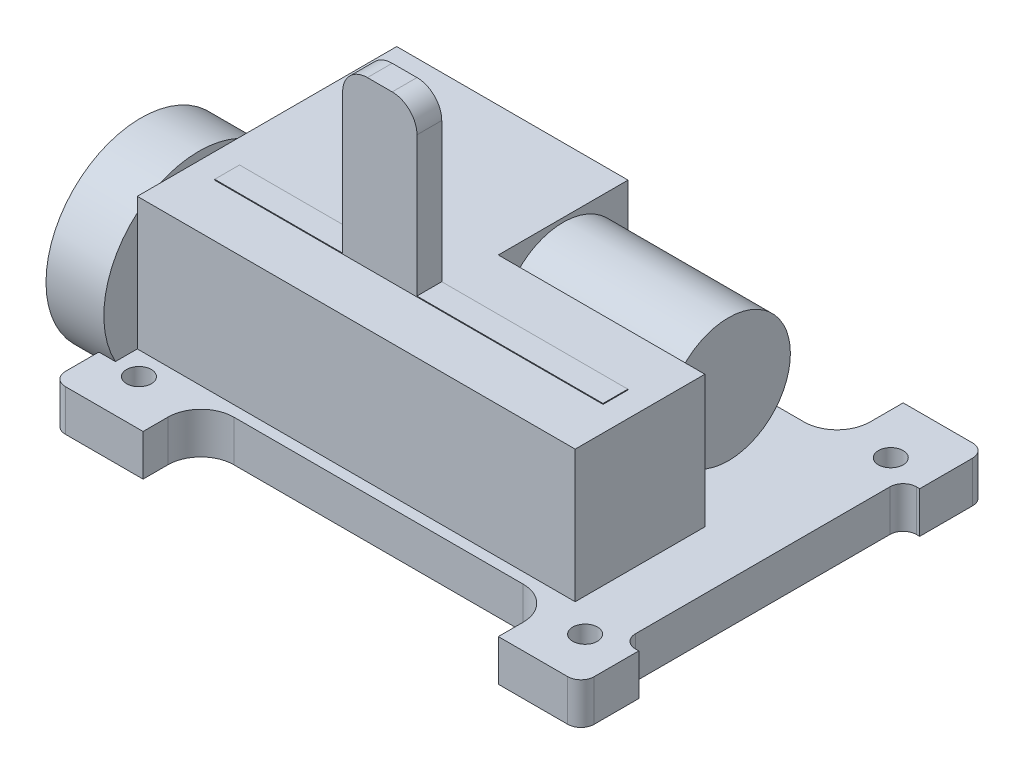
from build123d import *

# Parameters (mm, degrees)
SKETCH1_R            = 0.15
BOSS_EXTRUDE1_DEPTH  = 0.5
FILLET1_R            = 0.4
FILLET2_R            = 0.16
BOSS_EXTRUDE2_DEPTH  = 1.6
SKETCH3_R            = 0.75
BOSS_EXTRUDE7_DEPTH  = 2
SKETCH4_W            = 1.8
SKETCH4_H            = 1.8
BOSS_EXTRUDE8_DEPTH  = 0.3
SKETCH5_R            = 1.15
BOSS_EXTRUDE9_DEPTH  = 0.7
SKETCH6_W            = 0.9
SKETCH6_H            = 0.3
BOSS_EXTRUDE10_DEPTH = 2
FILLET3_R            = 0.3
SKETCH7_W            = 4.7
SKETCH7_H            = 0.3
BOSS_EXTRUDE11_DEPTH = 0.01


with BuildPart() as part:
    # Sketch1 → Boss-Extrude1 (new body)
    with BuildSketch(Plane(origin=(0, 0, 0), x_dir=(1, 0, 0), z_dir=(0, 1, 0))):
        Polygon((0, 0), (1.1, 0), (1.1, 0.7), (5.4, 0.7), (5.4, 0), (6.4, 0), (6.4, 0.7), (6.2, 0.7), (6.2, 4.1), (6.4, 4.1), (6.4, 4.9), (5.4, 4.9), (5.4, 4.1), (1.1, 4.1), (1.1, 4.9), (0, 4.9), (0, 4.1), (0.2, 4.1), (0.2, 0.7), (0, 0.7), align=None)
        with Locations(Location((0.5, 4.25, 0), (0, 0, 270))):
            Circle(SKETCH1_R, mode=Mode.SUBTRACT)
        with Locations(Location((0.5, 0.55, 0), (0, 0, 270))):
            Circle(SKETCH1_R, mode=Mode.SUBTRACT)
        with Locations(Location((5.9, 0.55, 0), (0, 0, 270))):
            Circle(SKETCH1_R, mode=Mode.SUBTRACT)
        with Locations(Location((5.9, 4.25, 0), (0, 0, 270))):
            Circle(SKETCH1_R, mode=Mode.SUBTRACT)
    extrude(amount=BOSS_EXTRUDE1_DEPTH)

    # Fillet1
    fillet1_edges = [part.edges().sort_by_distance(p)[0] for p in [
        (1.1, 0.25, -4.1),
        (5.4, 0.25, -4.1),
        (5.4, 0.25, -0.7),
        (1.1, 0.25, -0.7),
    ]]
    fillet(fillet1_edges, radius=FILLET1_R)

    # Fillet2
    fillet2_edges = [part.edges().sort_by_distance(p)[0] for p in [
        (0, 0.25, -0.7),
        (0.2, 0.25, -4.1),
        (0, 0.25, -4.9),
        (6.4, 0.25, -4.9),
        (6.2, 0.25, -4.1),
        (6.2, 0.25, -0.7),
        (6.4, 0.25, 0),
        (0, 0.25, 0),
    ]]
    fillet(fillet2_edges, radius=FILLET2_R)

    # Sketch2 → Boss-Extrude2 (add)
    with BuildSketch(Plane(origin=(0, 0.5, 0), x_dir=(1, 0, 0), z_dir=(0, 1, 0))):
        Polygon((0.2, 0.83), (5.5, 0.83), (5.5, 2.4), (3, 2.4), (3, 3.97), (0.2, 3.97), align=None)
    extrude(amount=BOSS_EXTRUDE2_DEPTH)

    # Sketch3 → Boss-Extrude7 (add)
    with BuildSketch(Plane(origin=(3, 0, 0), x_dir=(0, 0, -1), z_dir=(1, 0, 0))):
        with Locations(Location((3.185, 1.3, 0), (0, 0, 180))):
            Circle(SKETCH3_R)
    extrude(amount=BOSS_EXTRUDE7_DEPTH)

    # Sketch4 → Boss-Extrude8 (add)
    with BuildSketch(Plane.XZ):
        with Locations((3.25, -2.32)):
            Rectangle(SKETCH4_W, SKETCH4_H)
    extrude(amount=BOSS_EXTRUDE8_DEPTH)

    # Sketch5 → Boss-Extrude9 (add)
    with BuildSketch(Plane.ZY.offset(-0.2)):
        with Locations(Location((-1.575, 1.05, 0), (0, 0, 114.070614623))):
            Circle(SKETCH5_R)
    extrude(amount=BOSS_EXTRUDE9_DEPTH)

    # Sketch6 → Boss-Extrude10 (add)
    with BuildSketch(Plane(origin=(0, 2.1, 0), x_dir=(1, 0, 0), z_dir=(0, 1, 0))):
        with Locations((2.497976847, 1.617210326)):
            Rectangle(SKETCH6_W, SKETCH6_H)
    extrude(amount=BOSS_EXTRUDE10_DEPTH)

    # Fillet3
    fillet3_edges = [part.edges().sort_by_distance(p)[0] for p in [
        (2.047976847, 4.1, -1.617210326),
        (2.947976847, 4.1, -1.617210326),
    ]]
    fillet(fillet3_edges, radius=FILLET3_R)

    # Sketch7 → Boss-Extrude11 (add)
    with BuildSketch(Plane(origin=(0, 2.1, 0), x_dir=(1, 0, 0), z_dir=(0, 1, 0))):
        with Locations((2.85, 1.617210326)):
            Rectangle(SKETCH7_W, SKETCH7_H)
    extrude(amount=BOSS_EXTRUDE11_DEPTH)


solid = part.part
